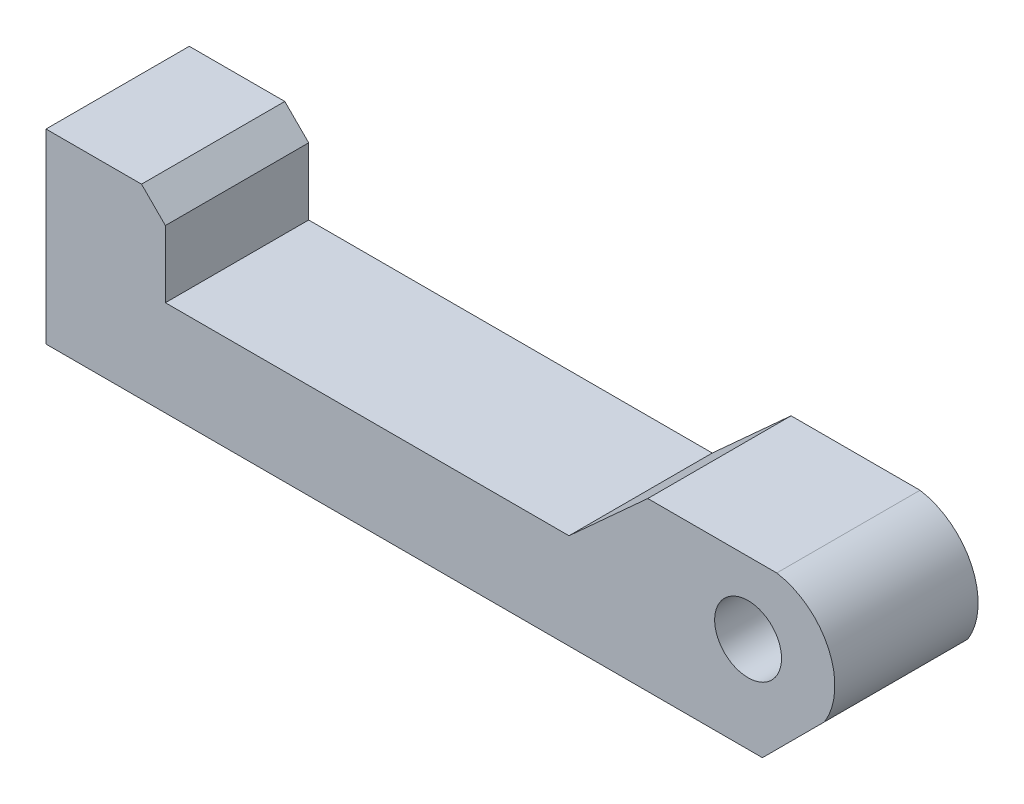
from build123d import *

# Parameters (mm, degrees)
SKETCH1_W                  = 16.3
SKETCH1_H                  = 3
BOSS_EXTRUDE1_DEPTH        = 2
SKETCH2_W                  = 2.9
SKETCH2_H                  = 3
BOSS_EXTRUDE2_DEPTH        = 1.5
SKETCH6_W                  = 0.8
SKETCH6_H                  = 1.5
BOSS_EXTRUDE4_DEPTH        = 3
F_1_4_1_4_DIAMETER_HOLE1_D = 1.4
CUT_EXTRUDE1_DEPTH         = 3
SKETCH9_W                  = 2.5
SKETCH9_H                  = 3
BOSS_EXTRUDE5_DEPTH        = 1.9
CUT_EXTRUDE2_DEPTH         = 10.520110293
CUT_EXTRUDE3_DEPTH         = 10
BOSS_EXTRUDE7_DEPTH        = 3


with BuildPart() as part:
    # Sketch1 → Boss-Extrude1 (new body)
    with BuildSketch(Plane(origin=(0, 0, 0), x_dir=(1, 0, 0), z_dir=(0, 1, 0))):
        Rectangle(SKETCH1_W, SKETCH1_H)
    extrude(amount=BOSS_EXTRUDE1_DEPTH)

    # Sketch2 → Boss-Extrude2 (add)
    with BuildSketch(Plane(origin=(0, 2, 0), x_dir=(1, 0, 0), z_dir=(0, 1, 0))):
        with Locations((5.9, 0)):
            Rectangle(SKETCH2_W, SKETCH2_H)
    extrude(amount=BOSS_EXTRUDE2_DEPTH)

    # Sketch6 → Boss-Extrude4 (add)
    with BuildSketch(Plane.XY.offset(1.5)):
        Polygon((4.45, 3.5), (2.8, 2), (4.45, 2), align=None)
        with Locations((7.75, 2.75)):
            Rectangle(SKETCH6_W, SKETCH6_H)
    extrude(amount=-BOSS_EXTRUDE4_DEPTH)

    # Ø1.4 (1.4) Diameter Hole1 (through all)
    with Locations(Plane.XY.offset(1.5)):
        with Locations((6.55, 2)):
            Hole(F_1_4_1_4_DIAMETER_HOLE1_D / 2)

    # Sketch8 → Cut-Extrude1 (cut)
    with BuildSketch(Plane.XY.offset(1.5)):
        Polygon((8.15, 0), (6.85, 0), (8.15, 1.3), align=None)
    extrude(amount=-CUT_EXTRUDE1_DEPTH, mode=Mode.SUBTRACT)

    # Sketch9 → Boss-Extrude5 (add)
    with BuildSketch(Plane(origin=(0, 2, 0), x_dir=(1, 0, 0), z_dir=(0, 1, 0))):
        with Locations((-6.9, 0)):
            Rectangle(SKETCH9_W, SKETCH9_H)
    extrude(amount=BOSS_EXTRUDE5_DEPTH)

    # Sketch10 → Cut-Extrude2 (cut, through all)
    with BuildSketch(Plane.XY.offset(1.5)):
        Polygon((-5.65, 3.9), (-5.65, 3.4), (-6.15, 3.9), align=None)
    extrude(amount=-CUT_EXTRUDE2_DEPTH, mode=Mode.SUBTRACT)

    # Sketch13 → Cut-Extrude3 (cut)
    with BuildSketch(Plane(origin=(0, 0, -1.5), x_dir=(-1, 0, 0), z_dir=(0, 0, -1))):
        Polygon((-8.15, 3.5), (-8.15, 2.5), (-7.15, 3.5), align=None)
    extrude(amount=-CUT_EXTRUDE3_DEPTH, mode=Mode.SUBTRACT)

    # Sketch14 → Boss-Extrude7 (add)
    with BuildSketch(Plane(origin=(0, 0, -1.5), x_dir=(-1, 0, 0), z_dir=(0, 0, -1))):
        with BuildLine():
            Line((-8.15, 1.3), (-7.15, 3.5))
            ThreePointArc((-7.15, 3.5), (-8.235707881, 2.666230855), (-8.15, 1.3))
        make_face()
    extrude(amount=-BOSS_EXTRUDE7_DEPTH)


solid = part.part
